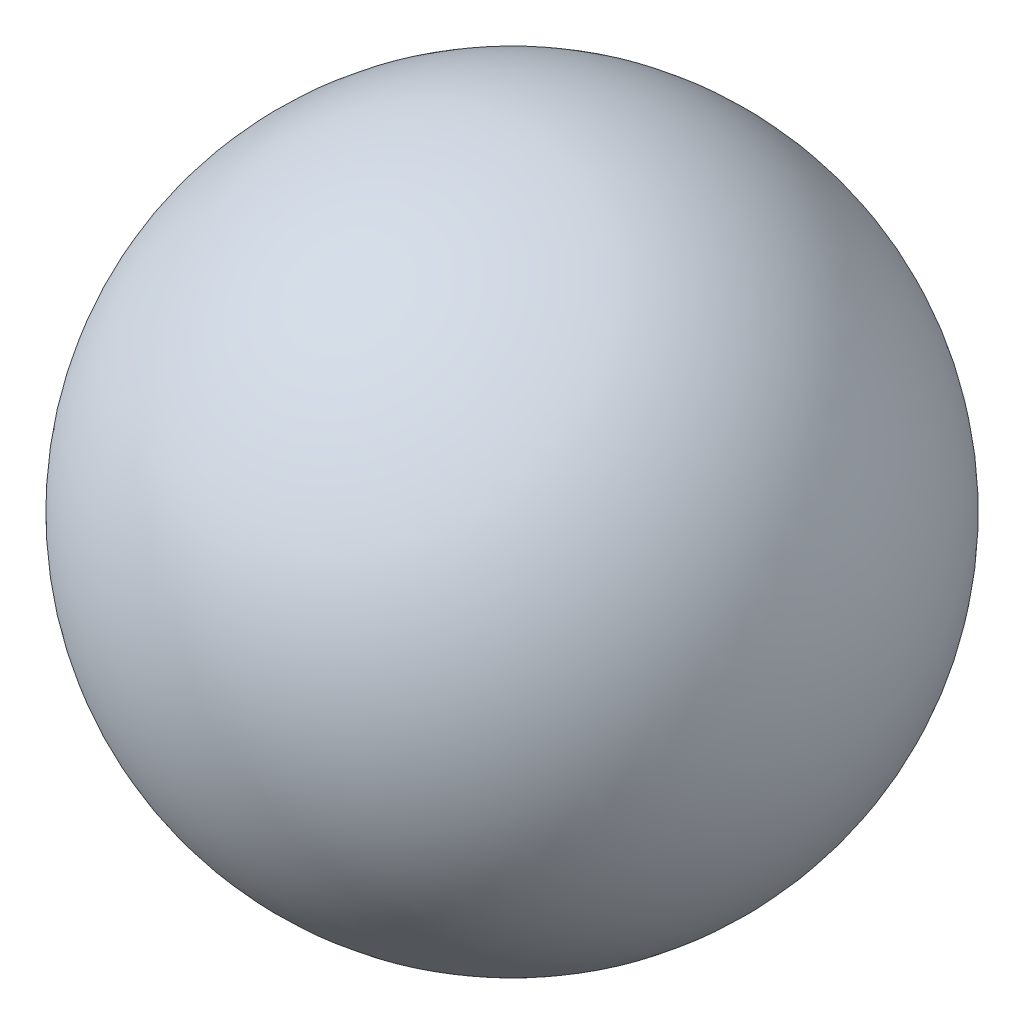
from build123d import *


with BuildPart() as part:
    # Sketch1 → Revolve1 (revolve)
    with BuildSketch(Plane.XY):
        with BuildLine():
            Line((0, 40), (0, -40))
            ThreePointArc((0, -40), (40, 0), (0, 40))
        make_face()
    revolve(axis=Axis((0, 40, 0), (0, -1, 0)))


solid = part.part
